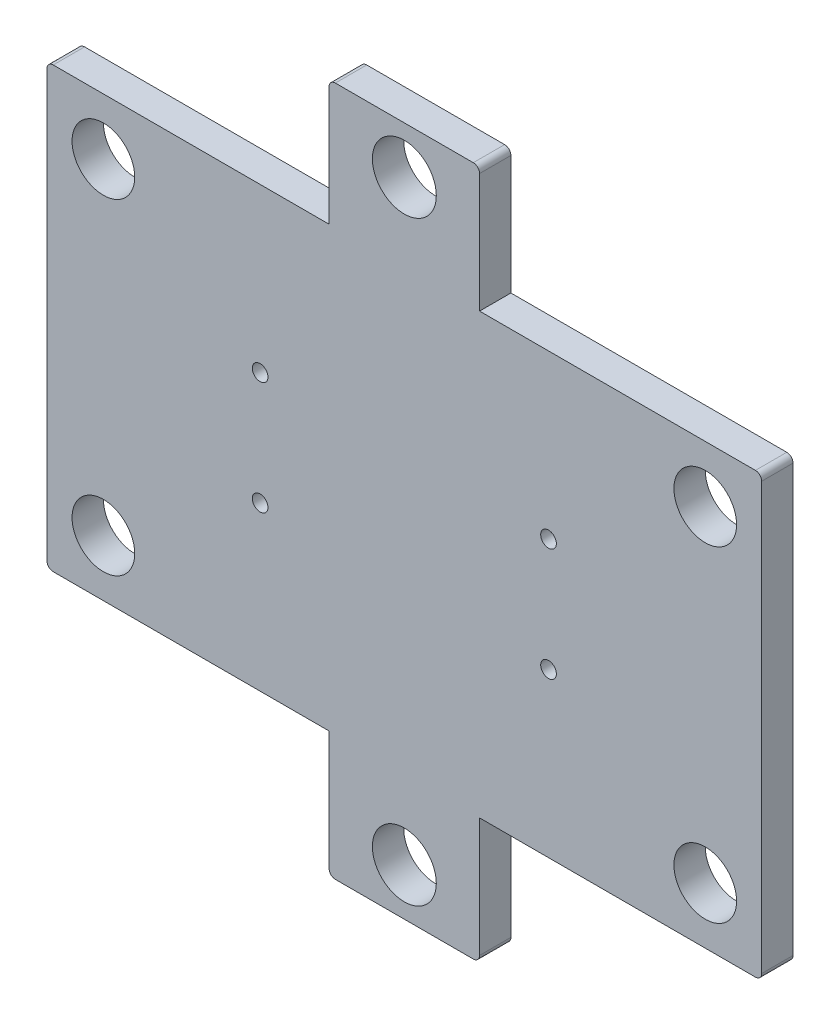
from build123d import *

# Parameters (mm, degrees)
EXTRUDE_1_DEPTH     = 5
FILLET_2_R          = 1
HOLE_WIZARD_M3_1_D  = 2.5
SKETCH_5_R          = 5
CUT_EXTRUDE_1_DEPTH = 5
HOLE_WIZARD_M12_1_D = 10.2


with BuildPart() as part:
    # 草图1 → 凸台-拉伸1 (new body)
    with BuildSketch(Plane.XY):
        Polygon((-57, 35), (-57, -35), (-12, -35), (-12, -55), (12, -55), (12, -35), (57, -35), (57, 35), (12, 35), (12, 55), (-12, 55), (-12, 35), align=None)
    extrude(amount=EXTRUDE_1_DEPTH)

    # 圆角2
    fillet_2_edges = [part.edges().sort_by_distance(p)[0] for p in [
        (-12, 55, 2.5),
        (12, 55, 2.5),
        (57, 35, 2.5),
        (57, -35, 2.5),
        (12, -55, 2.5),
        (-12, -55, 2.5),
        (-57, -35, 2.5),
        (-57, 35, 2.5),
    ]]
    fillet(fillet_2_edges, radius=FILLET_2_R)

    # M3 螺纹孔的螺纹孔钻头1 (through all)
    with Locations(Plane(origin=(-23, 9, 5), x_dir=(1, 0, 0), z_dir=(0, 0, 1))):
        with Locations((0, 0), (0, -18)):
            hole_wizard_m3_1 = Hole(HOLE_WIZARD_M3_1_D / 2)

    # 镜向1: M3 螺纹孔的螺纹孔钻头1 across plane
    add(hole_wizard_m3_1.mirror(Plane(origin=(0, 0, 0), x_dir=(0, 0, 1), z_dir=(1, 0, 0))), mode=Mode.SUBTRACT)

    # 草图5 → 切除-拉伸1 (cut)
    with BuildSketch(Plane.XY.offset(5)):
        with Locations((-48, 26)):
            Circle(SKETCH_5_R)
        with Locations((-48, -26)):
            Circle(SKETCH_5_R)
    cut_extrude_1 = extrude(amount=-CUT_EXTRUDE_1_DEPTH, mode=Mode.SUBTRACT)

    # 镜向2: 切除-拉伸1 across plane
    add(cut_extrude_1.mirror(Plane(origin=(0, 0, 0), x_dir=(0, 0, 1), z_dir=(1, 0, 0))), mode=Mode.SUBTRACT)

    # M12 螺纹孔的螺纹孔钻头1 (through all)
    with Locations(Plane(origin=(0, 47.5, 5), x_dir=(1, 0, 0), z_dir=(0, 0, 1))):
        with Locations((0, 0)):
            hole_wizard_m12_1 = Hole(HOLE_WIZARD_M12_1_D / 2)

    # 镜向3: M12 螺纹孔的螺纹孔钻头1 across plane
    add(hole_wizard_m12_1.mirror(Plane.ZX), mode=Mode.SUBTRACT)


solid = part.part
